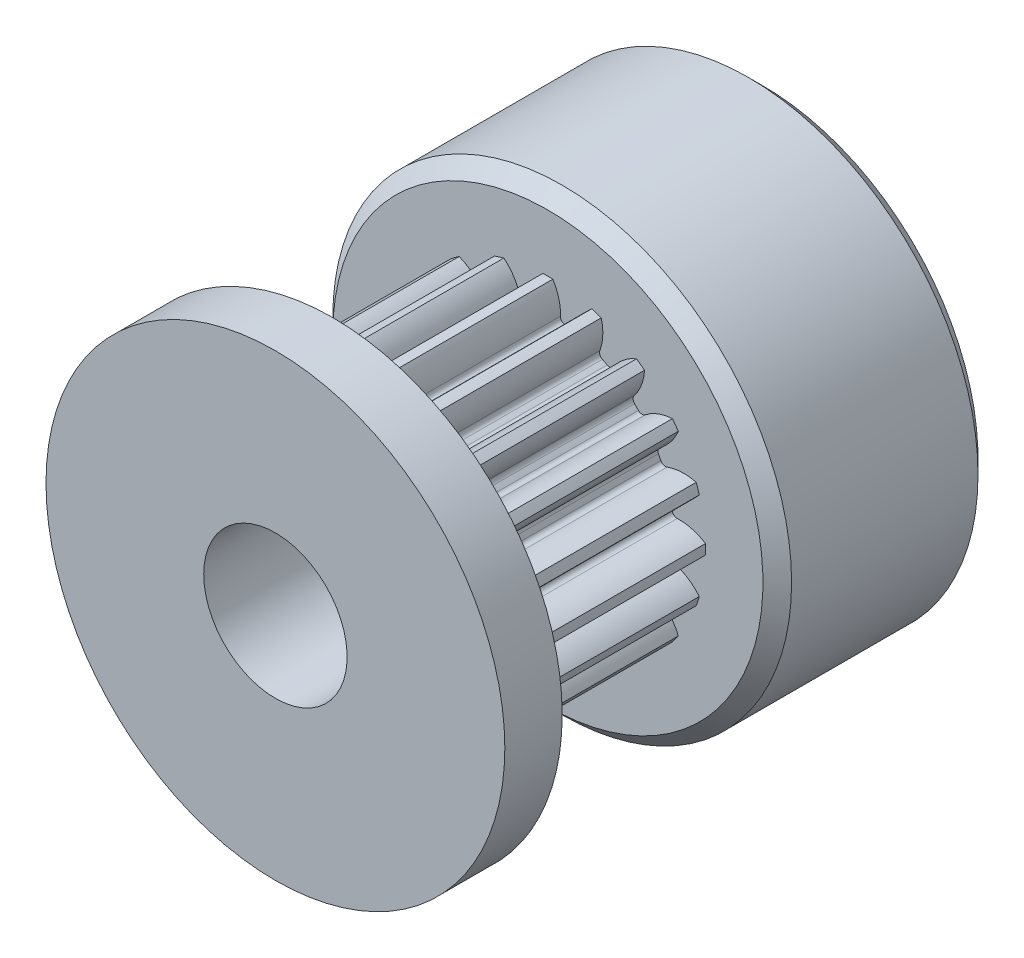
from build123d import *

# Parameters (mm, degrees)
ESQUISSE1_R                        = 1.15
BASE_EXTRUSION_DEPTH               = 2.5
BOSS_EXTRU_1_DEPTH                 = 7.5
CONG_1_R                           = 0.175
R_P_TITION_CIRCULAIRE4_COUNT       = 20
CONG_1_OF_R_P_TITION_CIRCULAIRE4_R = 0.175
SKETCH2_R                          = 8
BOSS_EXTRUDE1_DEPTH                = 2
BOSS_EXTRUDE2_START                = 7.5
SKETCH3_R                          = 8
BOSS_EXTRUDE2_DEPTH                = 7.5
SKETCH4_R                          = 2.5
CUT_EXTRUDE1_DEPTH                 = 21.420577935
CHAMFER1_SIZE                      = 0.5
SKETCH6_R                          = 2
CUT_EXTRUDE2_DEPTH                 = 15.773286811
SKETCH7_R                          = 2
CUT_EXTRUDE3_DEPTH                 = 15.773286876


with BuildPart() as part:
    # Esquisse1 → Base-Extrusion (new body)
    with BuildSketch(Plane.XY):
        Circle(ESQUISSE1_R)
    extrude(amount=BASE_EXTRUSION_DEPTH)

    # Esquisse3 → Boss.-Extru.1 (add)
    with BuildSketch(Plane.XY):
        with BuildLine():
            Line((-0.684400785, 4.32113649), (0, 0))
            Line((0, 0), (0.684400785, 4.32113649))
            ThreePointArc((0.684400785, 4.32113649), (0.555829687, 4.339548175), (0.426768711, 4.354135215))
            ThreePointArc((0.426768711, 4.354135215), (0.400825052, 4.947966893), (0.173691112, 5.497256716))
            ThreePointArc((0.173691112, 5.497256716), (0, 5.5), (-0.173691112, 5.497256716))
            ThreePointArc((-0.173691112, 5.497256716), (-0.400825052, 4.947966893), (-0.426768711, 4.354135215))
            ThreePointArc((-0.426768711, 4.354135215), (-0.555829687, 4.339548175), (-0.684400785, 4.32113649))
        make_face()
    boss_extru_1 = extrude(amount=BOSS_EXTRU_1_DEPTH)

    # Congé1
    cong_1_edges = [part.edges().sort_by_distance(p)[0] for p in [
        (0.426768711, 4.354135215, 3.75),
        (-0.426768711, 4.354135215, 3.75),
    ]]
    fillet(cong_1_edges, radius=CONG_1_R)

    # Répétition circulaire4: Boss.-Extru.1 ×20 about axis
    r_p_tition_circulaire4_axis = Axis((0, 0, 57.5), (0, 0, -1))
    for i in range(1, R_P_TITION_CIRCULAIRE4_COUNT):
        add(boss_extru_1.rotate(r_p_tition_circulaire4_axis, i * 360 / R_P_TITION_CIRCULAIRE4_COUNT))

    # Congé1 of Répétition circulaire4
    cong_1_of_r_p_tition_circulaire4_edges = [part.edges().sort_by_distance(p)[0] for p in [
        (1.751382941, 4.009149884, 3.75),
        (0.939620613, 4.272907453, 3.75),
        (2.904559606, 3.27172103, 3.75),
        (2.214033326, 3.773417739, 3.75),
        (3.773417739, 2.214033326, 3.75),
        (3.27172103, 2.904559606, 3.75),
        (4.272907453, 0.939620613, 3.75),
        (4.009149884, 1.751382941, 3.75),
        (4.354135215, -0.426768711, 3.75),
        (4.354135215, 0.426768711, 3.75),
        (4.009149884, -1.751382941, 3.75),
        (4.272907453, -0.939620613, 3.75),
        (3.27172103, -2.904559606, 3.75),
        (3.773417739, -2.214033326, 3.75),
        (2.214033326, -3.773417739, 3.75),
        (2.904559606, -3.27172103, 3.75),
        (0.939620613, -4.272907453, 3.75),
        (1.751382941, -4.009149884, 3.75),
        (-0.426768711, -4.354135215, 3.75),
        (0.426768711, -4.354135215, 3.75),
        (-1.751382941, -4.009149884, 3.75),
        (-0.939620613, -4.272907453, 3.75),
        (-2.904559606, -3.27172103, 3.75),
        (-2.214033326, -3.773417739, 3.75),
        (-3.773417739, -2.214033326, 3.75),
        (-3.27172103, -2.904559606, 3.75),
        (-4.272907453, -0.939620613, 3.75),
        (-4.009149884, -1.751382941, 3.75),
        (-4.354135215, 0.426768711, 3.75),
        (-4.354135215, -0.426768711, 3.75),
        (-4.009149884, 1.751382941, 3.75),
        (-4.272907453, 0.939620613, 3.75),
        (-3.27172103, 2.904559606, 3.75),
        (-3.773417739, 2.214033326, 3.75),
        (-2.214033326, 3.773417739, 3.75),
        (-2.904559606, 3.27172103, 3.75),
        (-0.939620613, 4.272907453, 3.75),
        (-1.751382941, 4.009149884, 3.75),
    ]]
    fillet(cong_1_of_r_p_tition_circulaire4_edges, radius=CONG_1_OF_R_P_TITION_CIRCULAIRE4_R)

    # Sketch2 → Boss-Extrude1 (add)
    with BuildSketch(Plane.XY.offset(7.5)):
        Circle(SKETCH2_R)
    extrude(amount=BOSS_EXTRUDE1_DEPTH)

    # Sketch3 → Boss-Extrude2 (add)
    with BuildSketch(Plane(origin=(0, 0, 0), x_dir=(-1, 0, 0), z_dir=(0, 0, -1)).offset(BOSS_EXTRUDE2_START)):
        Circle(SKETCH3_R)
    extrude(amount=-BOSS_EXTRUDE2_DEPTH)

    # Sketch4 → Cut-Extrude1 (cut, through all)
    with BuildSketch(Plane(origin=(0, 0, -7.5), x_dir=(-1, 0, 0), z_dir=(0, 0, -1))):
        Circle(SKETCH4_R)
    extrude(amount=-CUT_EXTRUDE1_DEPTH, mode=Mode.SUBTRACT)

    # Chamfer1
    chamfer1_edges = [part.edges().sort_by_distance(p)[0] for p in [
        (8, 0, 0),
        (8, 0, -7.5),
    ]]
    chamfer(chamfer1_edges, length=CHAMFER1_SIZE)

    # Sketch6 → Cut-Extrude2 (cut, through all)
    with BuildSketch(Plane(origin=(0, 0, 0), x_dir=(1, 0, 0), z_dir=(0, 1, 0))):
        with Locations((0, 3.75)):
            Circle(SKETCH6_R)
    extrude(amount=-CUT_EXTRUDE2_DEPTH, mode=Mode.SUBTRACT)

    # Sketch7 → Cut-Extrude3 (cut, through all)
    with BuildSketch(Plane(origin=(0, 0, 0), x_dir=(0, 0, -1), z_dir=(1, 0, 0))):
        with Locations((3.75, 0)):
            Circle(SKETCH7_R)
    extrude(amount=-CUT_EXTRUDE3_DEPTH, mode=Mode.SUBTRACT)


solid = part.part
